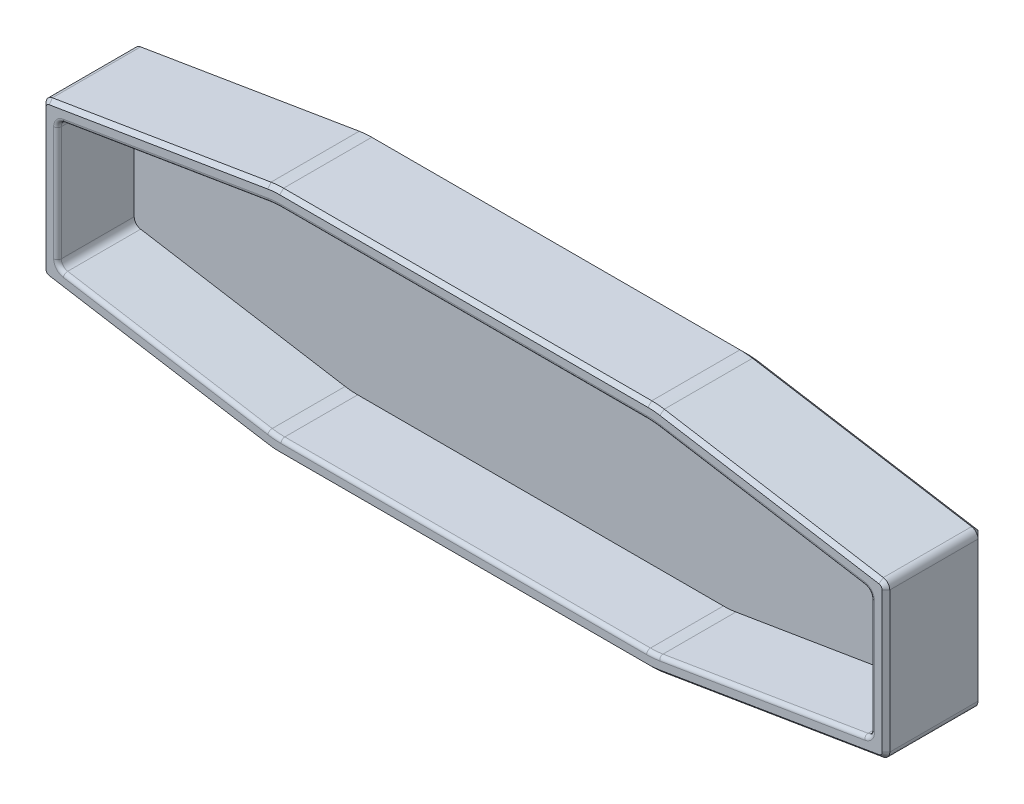
from build123d import *

# Parameters (mm, degrees)
BOSS_EXTRUDE1_DEPTH = 3
BOSS_EXTRUDE2_DEPTH = 3
BOSS_EXTRUDE3_DEPTH = 10
FILLET1_R           = 10
FILLET2_R           = 1
CHAMFER1_SIZE       = 1
CHAMFER2_SIZE       = 0.5
FILLET4_R           = 0.5


with BuildPart() as part:
    # Sketch1 → Boss-Extrude1 (new body)
    with BuildSketch(Plane.XY):
        Polygon((24.791261432, 15), (-24.85397009, 15), (-55, 10), (-55, -10), (-24.85397009, -15), (24.791261432, -15), (55, -10), (55, 10), align=None)
        Polygon((-53, 8.304395957), (-24.689236015, 13), (24.626864724, 13), (53, 8.303819918), (53, -8.303819918), (24.626864724, -13), (-24.689236015, -13), (-53, -8.304395957), align=None, mode=Mode.SUBTRACT)
    extrude(amount=-BOSS_EXTRUDE1_DEPTH)

    # Sketch3 → Boss-Extrude2 (add)
    with BuildSketch(Plane.XY):
        Polygon((-53, 8.304395957), (-53, -8.304395957), (-24.689236015, -13), (24.626864724, -13), (53, -8.303819918), (53, 8.303819918), (24.626864724, 13), (-24.689236015, 13), align=None)
    extrude(amount=-BOSS_EXTRUDE2_DEPTH)

    # Sketch1<4> → Boss-Extrude3 (add)
    with BuildSketch(Plane.XY):
        Polygon((24.791261432, 15), (-24.85397009, 15), (-55, 10), (-55, -10), (-24.85397009, -15), (24.791261432, -15), (55, -10), (55, 10), align=None)
        Polygon((-53, 8.304395957), (-24.689236015, 13), (24.626864724, 13), (53, 8.303819918), (53, -8.303819918), (24.626864724, -13), (-24.689236015, -13), (-53, -8.304395957), align=None, mode=Mode.SUBTRACT)
    extrude(amount=BOSS_EXTRUDE3_DEPTH)

    # Fillet1
    fillet1_edges = [part.edges().sort_by_distance(p)[0] for p in [
        (24.791261432, -15, 3.5),
        (24.626864724, -13, 5),
        (24.791261432, 15, 3.5),
        (24.626864724, 13, 5),
        (-24.689236015, 13, 5),
        (-24.85397009, 15, 3.5),
        (-24.689236015, -13, 5),
        (-24.85397009, -15, 3.5),
    ]]
    fillet(fillet1_edges, radius=FILLET1_R)

    # Fillet2
    fillet2_edges = [part.edges().sort_by_distance(p)[0] for p in [
        (55, 10, 3.5),
        (55, -10, 3.5),
        (53, -8.303819918, 5),
        (53, 8.303819918, 5),
        (-53, 8.304395957, 5),
        (-55, 10, 3.5),
        (-53, -8.304395957, 5),
        (-55, -10, 3.5),
    ]]
    fillet(fillet2_edges, radius=FILLET2_R)

    # Chamfer1
    chamfer1_edges = [part.edges().sort_by_distance(p)[0] for p in [
        (24.78849853, 14.966387387, -3),
        (-0.03051091, 15, -3),
        (-24.851190202, 14.966249987, -3),
        (-39.915081836, 12.501974258, -3),
        (-54.762766018, 9.79887255, -3),
        (-55, 0, -3),
        (-54.762766018, -9.79887255, -3),
        (-39.915081836, -12.501974258, -3),
        (-24.851190202, -14.966249987, -3),
        (-0.03051091, -15, -3),
        (24.78849853, -14.966387387, -3),
        (39.88275267, -12.50213151, -3),
        (54.762657657, -9.798712323, -3),
        (55, 0, -3),
        (54.762657657, 9.798712323, -3),
        (39.88275267, 12.50213151, -3),
    ]]
    chamfer(chamfer1_edges, length=CHAMFER1_SIZE)

    # Chamfer2
    chamfer2_edges = [part.edges().sort_by_distance(p)[0] for p in [
        (-54.762766018, -9.79887255, 10),
        (-39.915081836, -12.501974258, 10),
        (-55, 0, 10),
        (-24.851190202, -14.966249987, 10),
        (-54.762766018, 9.79887255, 10),
        (-0.03051091, -15, 10),
        (-39.915081836, 12.501974258, 10),
        (24.78849853, -14.966387387, 10),
        (-24.851190202, 14.966249987, 10),
        (39.88275267, -12.50213151, 10),
        (-0.03051091, 15, 10),
        (54.762657657, -9.798712323, 10),
        (24.78849853, 14.966387387, 10),
        (55, 0, 10),
        (54.762657657, 9.798712323, 10),
        (39.88275267, 12.50213151, 10),
    ]]
    chamfer(chamfer2_edges, length=CHAMFER2_SIZE)

    # Fillet4
    fillet4_edges = [part.edges().sort_by_distance(p)[0] for p in [
        (-24.686456127, 12.966249987, 10),
        (-38.832714799, 10.654172237, 10),
        (-52.762766018, 8.103268507, 10),
        (-53, 0, 10),
        (-52.762766018, -8.103268507, 10),
        (-38.832714799, -10.654172237, 10),
        (-24.686456127, -12.966249987, 10),
        (-0.030342226, -13, 10),
        (24.624101823, -12.966387387, 10),
        (38.800554316, -10.654041469, 10),
        (52.762657657, -8.10253224, 10),
        (53, 0, 10),
        (52.762657657, 8.10253224, 10),
        (38.800554316, 10.654041469, 10),
        (24.624101823, 12.966387387, 10),
        (-0.030342226, 13, 10),
    ]]
    fillet(fillet4_edges, radius=FILLET4_R)


solid = part.part
